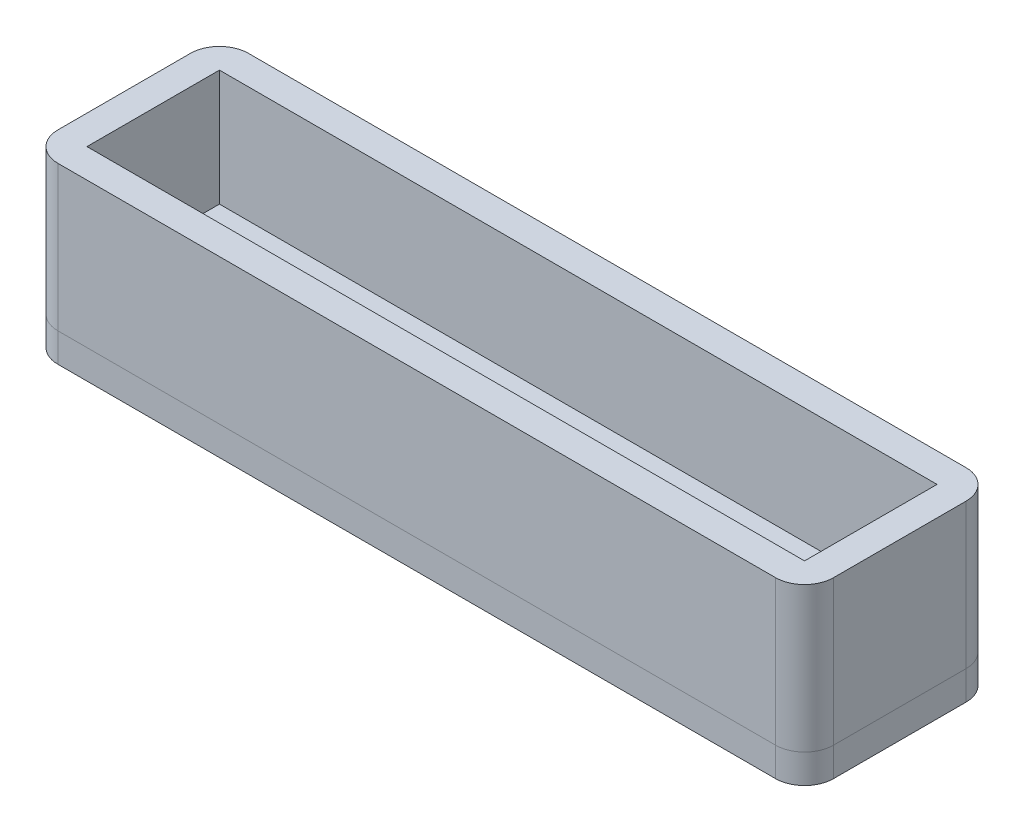
from build123d import *

# Parameters (mm, degrees)
SKETCH1_W           = 74.2
SKETCH1_H           = 13.7
BOSS_EXTRUDE1_DEPTH = 3
SKETCH2_W           = 80.2
SKETCH2_H           = 19.7
SKETCH2_W_2         = 74.2
SKETCH2_H_2         = 13.7
BOSS_EXTRUDE2_DEPTH = 15
FILLET1_R           = 3
BOSS_EXTRUDE3_DEPTH = 3


with BuildPart() as part:
    # Sketch1 → Boss-Extrude1 (new body)
    with BuildSketch(Plane(origin=(0, 0, 0), x_dir=(1, 0, 0), z_dir=(0, 1, 0))):
        with Locations((37.1, 6.85)):
            Rectangle(SKETCH1_W, SKETCH1_H)
    extrude(amount=BOSS_EXTRUDE1_DEPTH)

    # Sketch2 → Boss-Extrude2 (add)
    with BuildSketch(Plane.XZ):
        with Locations((37.1, -6.85)):
            Rectangle(SKETCH2_W, SKETCH2_H)
        with Locations((37.1, -6.85)):
            Rectangle(SKETCH2_W_2, SKETCH2_H_2, mode=Mode.SUBTRACT)
    extrude(amount=-BOSS_EXTRUDE2_DEPTH)

    # Fillet1
    fillet1_edges = [part.edges().sort_by_distance(p)[0] for p in [
        (77.2, 7.5, 3),
        (77.2, 7.5, -16.7),
        (-3, 7.5, -16.7),
        (-3, 7.5, 3),
    ]]
    fillet(fillet1_edges, radius=FILLET1_R)


with BuildPart() as body_2:
    # Sketch3 → Boss-Extrude3 (new body)
    with BuildSketch(Plane.XZ):
        with BuildLine():
            Line((77.2, -13.7), (77.2, 0))
            ThreePointArc((77.2, 0), (76.321320344, 2.121320344), (74.2, 3))
            Line((74.2, 3), (0, 3))
            ThreePointArc((0, 3), (-2.121320344, 2.121320344), (-3, 0))
            Line((-3, 0), (-3, -13.7))
            ThreePointArc((-3, -13.7), (-2.121320344, -15.821320344), (0, -16.7))
            Line((0, -16.7), (74.2, -16.7))
            ThreePointArc((74.2, -16.7), (76.321320344, -15.821320344), (77.2, -13.7))
        make_face()
    extrude(amount=BOSS_EXTRUDE3_DEPTH)


solid = Compound([part.part, body_2.part])
